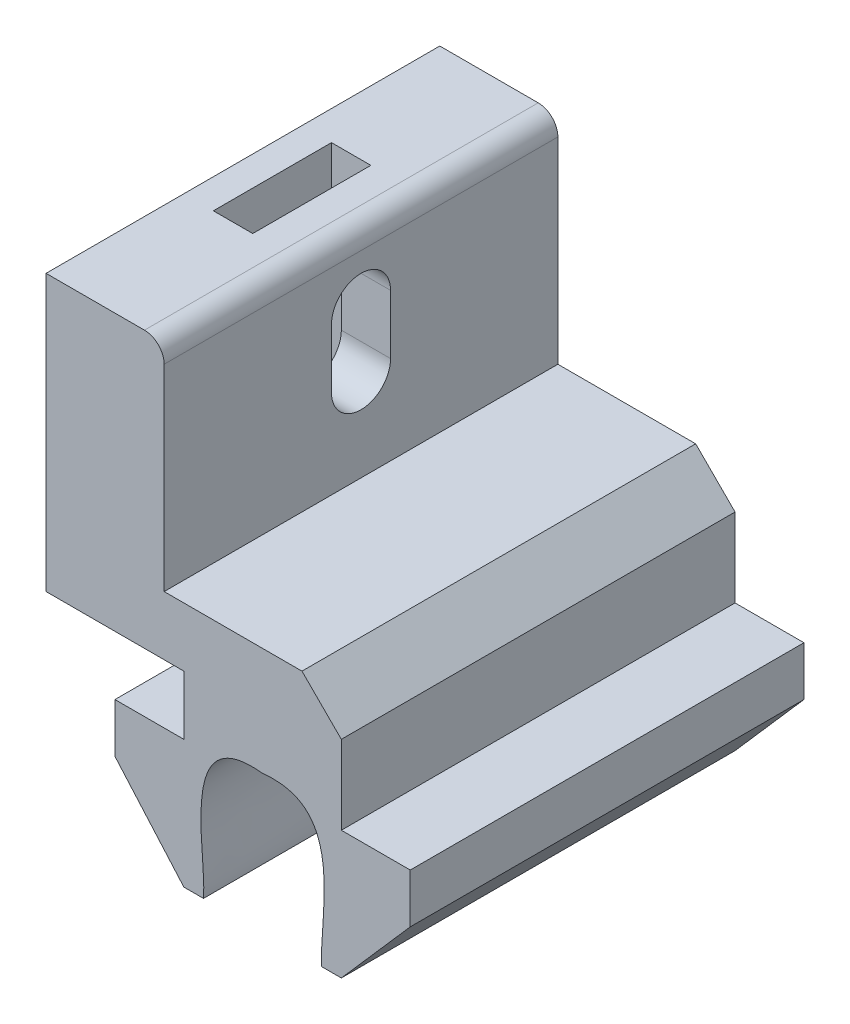
from build123d import *

# Parameters (mm, degrees)
ESTRUSIONE_ESTRUSIONE1_DEPTH  = 20
TAGLIO_ESTRUSIONE1_REACH      = 37.979
SCHIZZO12_W                   = 2
SCHIZZO12_H                   = 6
TAGLIO_ESTRUSIONE2_DEPTH      = 11
TAGLIO_ESTRUSIONE3_DEPTH      = 33.760494502
TAGLIO_ESTRUSIONE3_DEPTH_BACK = 33.760494502
SMUSSO1_SIZE                  = 2


with BuildPart() as part:
    # Schizzo2 → Estrusione-Estrusione1 (new body)
    with BuildSketch(Plane.XY):
        with BuildLine():
            Line((-4, 9.5), (-11, 9.5))
            Line((-11, 9.5), (-11, 23.5))
            Line((-11, 23.5), (-6, 23.5))
            ThreePointArc((-6, 23.5), (-5.292893219, 23.207106781), (-5, 22.5))
            Line((-5, 22.5), (-5, 12.5))
            Line((-5, 12.5), (4, 12.5))
            Line((4, 12.5), (4, 9.5))
            Line((4, 9.5), (4, 6.5))
            Line((4, 6.5), (7.5, 6.5))
            Line((7.5, 6.5), (7.5, 4))
            Line((7.5, 4), (4, 0))
            Line((4, 0), (-4, 0))
            Line((-4, 0), (-7.5, 4))
            Line((-7.5, 4), (-7.5, 6.5))
            Line((-7.5, 6.5), (-4, 6.5))
            Line((-4, 6.5), (-4, 9.5))
        make_face()
    extrude(amount=-ESTRUSIONE_ESTRUSIONE1_DEPTH)

    # Schizzo6 → Taglio-Estrusione1 (cut, up to next)
    with BuildSketch(Plane.ZY.offset(11), mode=Mode.PRIVATE) as taglio_estrusione1_sk1:
        with BuildLine():
            Line((-8.5, 20), (-8.5, 17))
            ThreePointArc((-8.5, 17), (-10, 15.5), (-11.5, 17))
            Line((-11.5, 17), (-11.5, 20))
            ThreePointArc((-11.5, 20), (-10, 21.5), (-8.5, 20))
        make_face()
    taglio_estrusione1_tool1 = extrude(taglio_estrusione1_sk1.sketch, amount=-TAGLIO_ESTRUSIONE1_REACH, mode=Mode.PRIVATE) & part.part
    add(taglio_estrusione1_tool1.solids().sort_by_distance((-11, 18.5, -10))[0], mode=Mode.SUBTRACT)

    # Schizzo12 → Taglio-Estrusione2 (cut)
    with BuildSketch(Plane(origin=(0, 23.5, 0), x_dir=(1, 0, 0), z_dir=(0, 1, 0))):
        with Locations((-8.5, 10)):
            Rectangle(SCHIZZO12_W, SCHIZZO12_H)
    extrude(amount=-TAGLIO_ESTRUSIONE2_DEPTH, mode=Mode.SUBTRACT)

    # Schizzo13 → Taglio-Estrusione3 (cut, two sides: drawn at the far end of the back side and taken through both)
    with BuildSketch(Plane(origin=(0, 0, -20), x_dir=(-1, 0, 0), z_dir=(0, 0, -1)).offset(-TAGLIO_ESTRUSIONE3_DEPTH_BACK)):
        with BuildLine():
            add(Edge.make_bspline(
                [(-3, 0), (-2.831721027, 2.145011642), (-4.377617752, 7.500745545), (0, 7)],
                knots=[0, 0, 0, 0, 1, 1, 1, 1], degree=3))
            Line((-3, 0), (3, 0))
            add(Edge.make_bspline(
                [(3, 0), (2.831721027, 2.145011642), (4.377617752, 7.500745545), (0, 7)],
                knots=[0, 0, 0, 0, 1, 1, 1, 1], degree=3))
        make_face()
    extrude(amount=TAGLIO_ESTRUSIONE3_DEPTH + TAGLIO_ESTRUSIONE3_DEPTH_BACK, mode=Mode.SUBTRACT)

    # Smusso1
    smusso1_edges = [part.edges().sort_by_distance(p)[0] for p in [
        (4, 12.5, -10),
    ]]
    chamfer(smusso1_edges, length=SMUSSO1_SIZE)


solid = part.part
